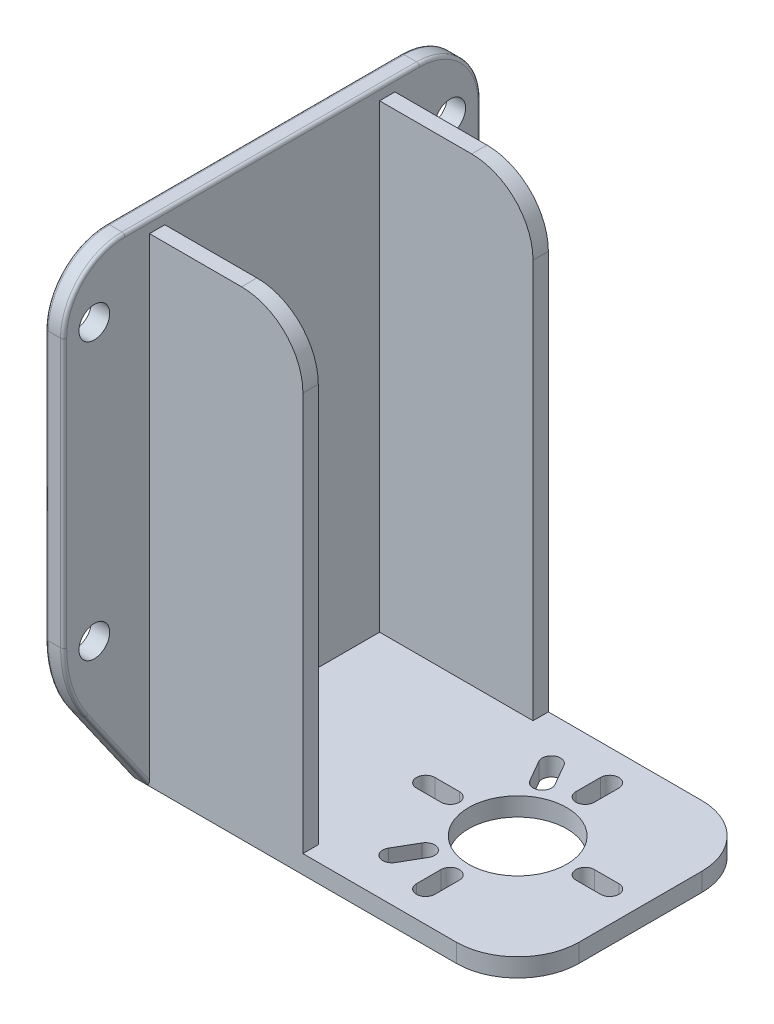
from build123d import *

# Parameters (mm, degrees)
SKETCH_1_W          = 60
SKETCH_1_H          = 40
SKETCH_1_R          = 8
EXTRUDE_1_DEPTH     = 3
EXTRUDE_2_DEPTH     = 3
SKETCH_6_W          = 3
SKETCH_6_H          = 68.008301529
EXTRUDE_3_DEPTH     = 60
SKETCH_7_R          = 2.5
CUT_EXTRUDE_1_DEPTH = 121.443081137
FILLET_1_R          = 10
FILLET_2_R          = 20
FILLET_4_R          = 10
FILLET_12_R         = 0.5
FILLET_13_R         = 0.5
SKETCH_10_W         = 25
SKETCH_10_H         = 2.5
EXTRUDE_6_DEPTH     = 75
FILLET_16_R         = 10


with BuildPart() as part:
    # 草图1 → 凸台-拉伸1 (new body)
    with BuildSketch(Plane(origin=(0, 0, 0), x_dir=(1, 0, 0), z_dir=(0, 1, 0))):
        with Locations((-43.647943628, 33.126585816)):
            Rectangle(SKETCH_1_W, SKETCH_1_H)
        with Locations(Location((-33.647943628, 33.126585816, 0), (0, 0, 270))):
            Circle(SKETCH_1_R, mode=Mode.SUBTRACT)
        with BuildLine():
            Line((-18.647943628, 31.626585816), (-22.647943628, 31.626585816))
            ThreePointArc((-22.647943628, 31.626585816), (-24.147943628, 33.126585816), (-22.647943628, 34.626585816))
            Line((-22.647943628, 34.626585816), (-18.647943628, 34.626585816))
            ThreePointArc((-18.647943628, 34.626585816), (-17.147943628, 33.126585816), (-18.647943628, 31.626585816))
        make_face(mode=Mode.SUBTRACT)
        with BuildLine():
            Line((-35.147943628, 18.126585816), (-35.147943628, 22.126585816))
            ThreePointArc((-35.147943628, 22.126585816), (-33.647943628, 23.626585816), (-32.147943628, 22.126585816))
            Line((-32.147943628, 22.126585816), (-32.147943628, 18.126585816))
            ThreePointArc((-32.147943628, 18.126585816), (-33.647943628, 16.626585816), (-35.147943628, 18.126585816))
        make_face(mode=Mode.SUBTRACT)
        with BuildLine():
            Line((-48.647943628, 34.626585816), (-44.647943628, 34.626585816))
            ThreePointArc((-44.647943628, 34.626585816), (-43.147943628, 33.126585816), (-44.647943628, 31.626585816))
            Line((-44.647943628, 31.626585816), (-48.647943628, 31.626585816))
            ThreePointArc((-48.647943628, 31.626585816), (-50.147943628, 33.126585816), (-48.647943628, 34.626585816))
        make_face(mode=Mode.SUBTRACT)
        with BuildLine():
            Line((-32.147943628, 48.126585816), (-32.147943628, 44.126585816))
            ThreePointArc((-32.147943628, 44.126585816), (-33.647943628, 42.626585816), (-35.147943628, 44.126585816))
            Line((-35.147943628, 44.126585816), (-35.147943628, 48.126585816))
            ThreePointArc((-35.147943628, 48.126585816), (-33.647943628, 49.626585816), (-32.147943628, 48.126585816))
        make_face(mode=Mode.SUBTRACT)
        with BuildLine():
            Line((-42.446981734, 20.88620476), (-40.446981734, 24.350306375))
            ThreePointArc((-40.446981734, 24.350306375), (-38.397943628, 24.89934448), (-37.848905522, 22.850306375))
            Line((-37.848905522, 22.850306375), (-39.848905522, 19.38620476))
            ThreePointArc((-39.848905522, 19.38620476), (-41.897943628, 18.837166654), (-42.446981734, 20.88620476))
        make_face(mode=Mode.SUBTRACT)
        with BuildLine():
            Line((-39.848905522, 46.866966873), (-37.848905522, 43.402865258))
            ThreePointArc((-37.848905522, 43.402865258), (-38.397943628, 41.353827152), (-40.446981734, 41.902865258))
            Line((-40.446981734, 41.902865258), (-42.446981734, 45.366966873))
            ThreePointArc((-42.446981734, 45.366966873), (-41.897943628, 47.416004979), (-39.848905522, 46.866966873))
        make_face(mode=Mode.SUBTRACT)
    extrude(amount=EXTRUDE_1_DEPTH)

    # 草图2 → 凸台-拉伸2 (add)
    with BuildSketch(Plane.ZY.offset(73.647943628)):
        Polygon((-67.130736581, 20), (-53.126585816, 0), (-13.126585816, 0), (0.877564948, 20), align=None)
    extrude(amount=EXTRUDE_2_DEPTH)

    # 草图6 → 凸台-拉伸3 (add)
    with BuildSketch(Plane(origin=(0, 20, 0), x_dir=(1, 0, 0), z_dir=(0, 1, 0))):
        with Locations((-75.147943628, 33.126585817)):
            Rectangle(SKETCH_6_W, SKETCH_6_H)
    extrude(amount=EXTRUDE_3_DEPTH)

    # 草图7 → 切除-拉伸1 (cut, through all)
    with BuildSketch(Plane(origin=(-73.647943628, 0, 0), x_dir=(0, 0, -1), z_dir=(1, 0, 0))):
        with Locations((62.130736581, 25)):
            Circle(SKETCH_7_R)
        with Locations((4.130736581, 25)):
            Circle(SKETCH_7_R)
        with Locations((62.130736581, 70)):
            Circle(SKETCH_7_R)
        with Locations((4.130736581, 70)):
            Circle(SKETCH_7_R)
    extrude(amount=-CUT_EXTRUDE_1_DEPTH, mode=Mode.SUBTRACT)

    # 圆角1
    fillet_1_edges = [part.edges().sort_by_distance(p)[0] for p in [
        (-13.647943628, 1.5, -53.126585816),
        (-13.647943628, 1.5, -13.126585816),
    ]]
    fillet(fillet_1_edges, radius=FILLET_1_R)

    # 圆角2
    fillet_2_edges = [part.edges().sort_by_distance(p)[0] for p in [
        (-75.147943628, 20, 0.877564948),
        (-75.147943628, 20, -67.130736581),
    ]]
    fillet(fillet_2_edges, radius=FILLET_2_R)

    # 圆角4
    fillet_4_edges = [part.edges().sort_by_distance(p)[0] for p in [
        (-75.147943628, 80, -67.130736581),
        (-75.147943628, 80, 0.877564948),
    ]]
    fillet(fillet_4_edges, radius=FILLET_4_R)

    # 圆角12
    fillet_12_edges = [part.edges().sort_by_distance(p)[0] for p in [
        (-73.647943628, 7.417223525, -7.932989991),
        (-73.647943628, 7.417223525, -58.320181641),
        (-73.647943628, 20.291859787, -0.048096037),
        (-73.647943628, 20.291859787, -66.205075596),
        (-73.647943628, 80, -33.126585816),
        (-73.647943628, 48.152987889, -67.130736581),
        (-73.647943628, 48.152987889, 0.877564948),
        (-73.647943628, 77.071067812, -64.201804393),
        (-73.647943628, 77.071067812, -2.05136724),
    ]]
    fillet(fillet_12_edges, radius=FILLET_12_R)

    # 圆角13
    fillet_13_edges = [part.edges().sort_by_distance(p)[0] for p in [
        (-76.647943628, 7.417223525, -7.932989991),
        (-76.647943628, 7.417223525, -58.320181641),
        (-76.647943628, 20.291859787, -0.048096037),
        (-76.647943628, 20.291859787, -66.205075596),
        (-76.647943628, 80, -33.126585816),
        (-76.647943628, 48.152987889, 0.877564948),
        (-76.647943628, 48.152987889, -67.130736581),
        (-76.647943628, 77.071067812, -64.201804393),
        (-76.647943628, 77.071067812, -2.05136724),
    ]]
    fillet(fillet_13_edges, radius=FILLET_13_R)

    # 草图10 → 凸台-拉伸6 (add)
    with BuildSketch(Plane(origin=(0, 3, 0), x_dir=(1, 0, 0), z_dir=(0, 1, 0))):
        with Locations((-61.147943628, 51.876585816)):
            Rectangle(SKETCH_10_W, SKETCH_10_H)
        with Locations((-61.147943628, 14.376585816)):
            Rectangle(SKETCH_10_W, SKETCH_10_H)
    extrude(amount=EXTRUDE_6_DEPTH)

    # 圆角16
    fillet_16_edges = [part.edges().sort_by_distance(p)[0] for p in [
        (-48.647943628, 78, -51.876585816),
        (-48.647943628, 78, -14.376585816),
    ]]
    fillet(fillet_16_edges, radius=FILLET_16_R)


solid = part.part
